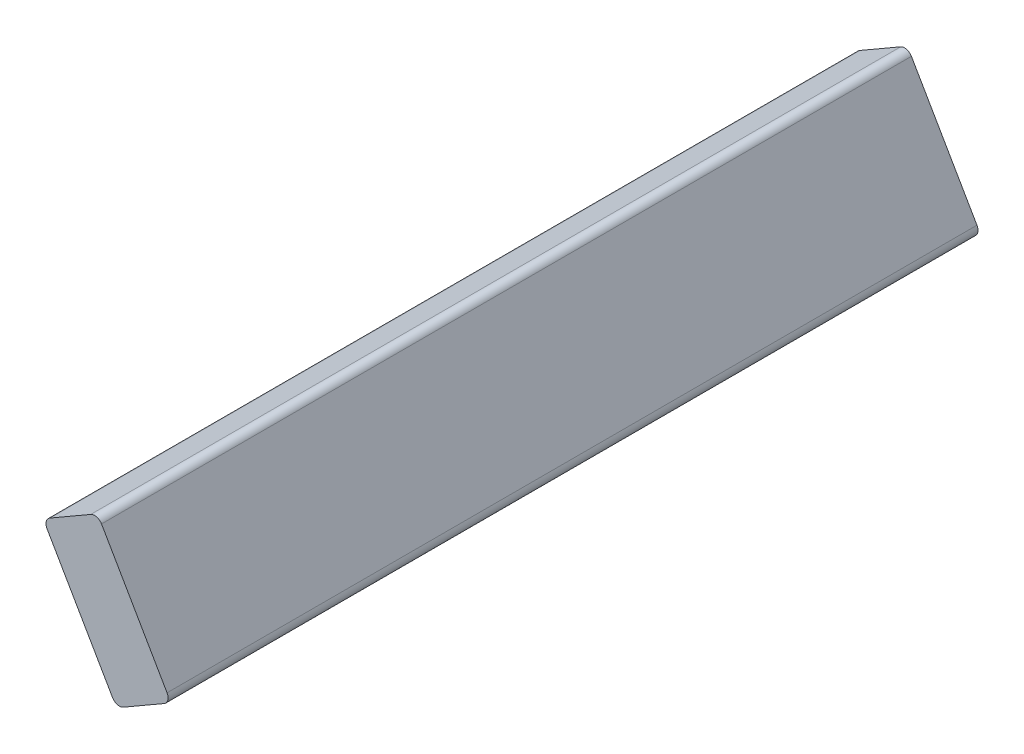
from build123d import *

# Parameters (mm, degrees)
BOSS_EXTRUDE1_DEPTH = 490.53796101
FILLET1_R           = 4.7625


with BuildPart() as part:
    # Sketch1 → Boss-Extrude1 (new body)
    with BuildSketch(Plane.XY):
        Polygon((227.693380197, -470.576503047), (183.243380197, -393.586844651), (216.238948081, -374.536844651), (260.688948081, -451.526503047), align=None)
    extrude(amount=BOSS_EXTRUDE1_DEPTH)

    # Fillet1
    fillet1_edges = [part.edges().sort_by_distance(p)[0] for p in [
        (227.693380197, -470.576503047, 245.268980505),
        (183.243380197, -393.586844651, 245.268980505),
        (216.238948081, -374.536844651, 245.268980505),
        (260.688948081, -451.526503047, 245.268980505),
    ]]
    fillet(fillet1_edges, radius=FILLET1_R)


solid = part.part
